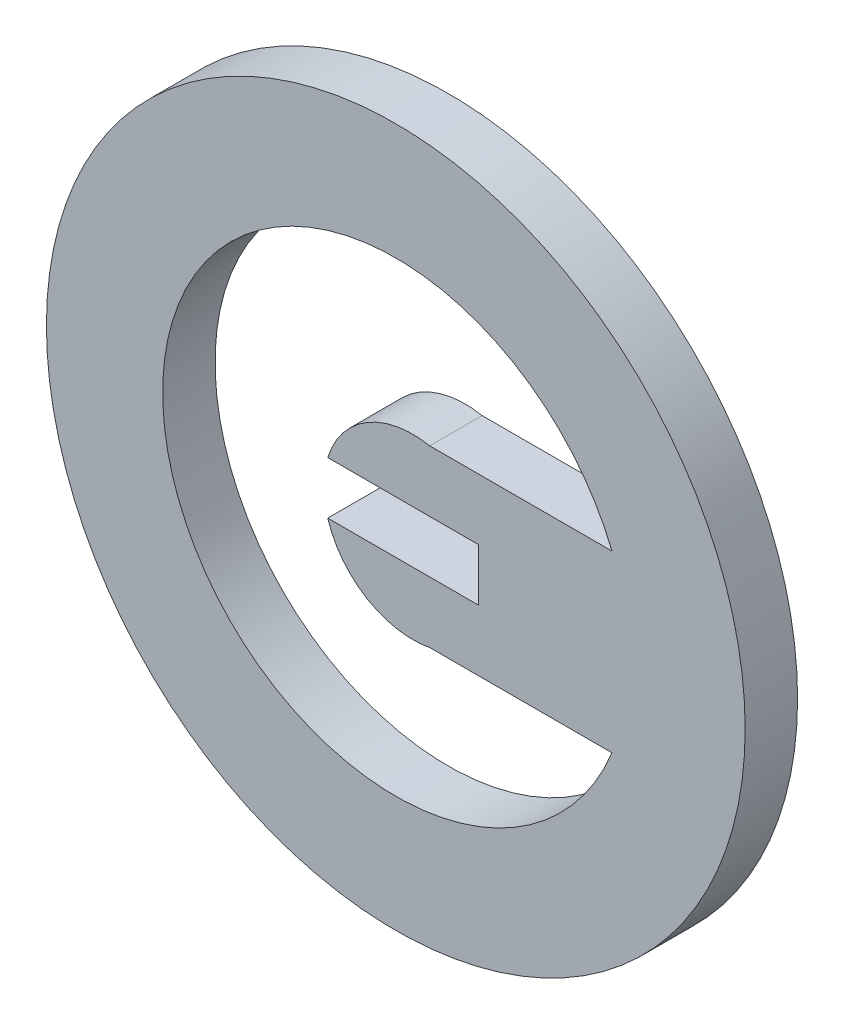
from build123d import *

# Parameters (mm, degrees)
SKETCH1_R          = 20
BASE_EXTRUDE_DEPTH = 3


with BuildPart() as part:
    # Sketch1 → Base-Extrude (new body)
    with BuildSketch(Plane.XY):
        with Locations(Location((0, 0, 0), (0, 0, 180))):
            Circle(SKETCH1_R)
        with BuildLine():
            Line((1.944214305, 5), (12.373449734, 5))
            ThreePointArc((12.373449734, 5), (-13.345495806, 0), (12.373449734, -5))
            Line((12.373449734, -5), (1.944214305, -5))
            ThreePointArc((1.944214305, -5), (-1.64638645, -4.369036915), (-3.895643079, -1.5))
            Line((-3.895643079, -1.5), (4.736201703, -1.5))
            Line((4.736201703, -1.5), (4.736201703, 1.5))
            Line((4.736201703, 1.5), (-3.895643079, 1.5))
            ThreePointArc((-3.895643079, 1.5), (-1.64638645, 4.369036915), (1.944214305, 5))
        make_face(mode=Mode.SUBTRACT)
    extrude(amount=BASE_EXTRUDE_DEPTH)


solid = part.part
